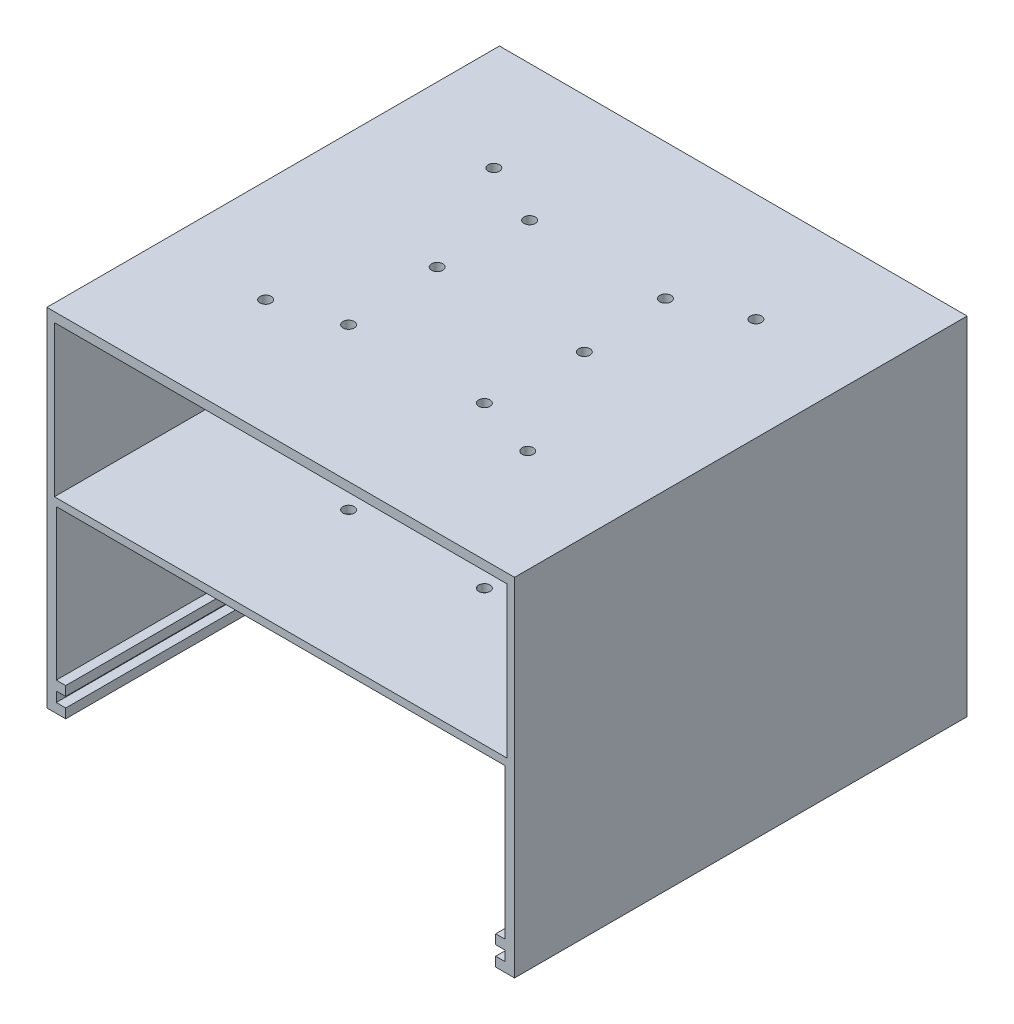
from build123d import *

# Parameters (mm, degrees)
SKETCH_2_W          = 124
SKETCH_2_H          = 120
EXTRUDE_1_DEPTH     = 2
SKETCH_3_W          = 2
SKETCH_3_H          = 120
EXTRUDE_2_DEPTH     = 40
SKETCH_4_W          = 120
SKETCH_4_H          = 2
EXTRUDE_3_DEPTH     = 5
SKETCH_6_W          = 124
SKETCH_6_H          = 120
EXTRUDE_4_DEPTH     = 2.5
SKETCH_9_W          = 124
SKETCH_9_H          = 1.5
EXTRUDE_5_DEPTH     = 25
SKETCH_10_R         = 1.5
CUT_EXTRUDE_2_DEPTH = 1.5
SKETCH_11_R         = 1.5
CUT_EXTRUDE_3_DEPTH = 51
SKETCH_12_W         = 2.5
SKETCH_12_H         = 120
EXTRUDE_6_DEPTH     = 47.5
SKETCH_14_W         = 2.5
SKETCH_14_H         = 2.5
EXTRUDE_8_DEPTH     = 120
SKETCH_15_W         = 119
SKETCH_15_H         = 3
EXTRUDE_9_DEPTH     = 47.5
SKETCH_16_R         = 2.5
CUT_EXTRUDE_4_DEPTH = 10
SKETCH_18_W         = 2.5
SKETCH_18_H         = 2.5
EXTRUDE_10_DEPTH    = 120
SKETCH_20_W         = 124
SKETCH_20_H         = 25
CUT_EXTRUDE_5_DEPTH = 10
SKETCH_19_R         = 1.5
CUT_EXTRUDE_6_DEPTH = 2.5


with BuildPart() as part:
    # 草图2 → 凸台-拉伸1 (new body)
    with BuildSketch(Plane(origin=(0, 0, 0), x_dir=(1, 0, 0), z_dir=(0, 1, 0))):
        Rectangle(SKETCH_2_W, SKETCH_2_H)
    extrude(amount=EXTRUDE_1_DEPTH)

    # 草图3 → 凸台-拉伸2 (add)
    with BuildSketch(Plane(origin=(0, 2, 0), x_dir=(1, 0, 0), z_dir=(0, 1, 0))):
        with Locations((-61, 0)):
            Rectangle(SKETCH_3_W, SKETCH_3_H)
        with Locations((61, 0)):
            Rectangle(SKETCH_3_W, SKETCH_3_H)
    extrude(amount=EXTRUDE_2_DEPTH)

    # 草图4 → 凸台-拉伸3 (add)
    with BuildSketch(Plane(origin=(0, 2, 0), x_dir=(1, 0, 0), z_dir=(0, 1, 0))):
        with Locations((0, 59)):
            Rectangle(SKETCH_4_W, SKETCH_4_H)
    extrude(amount=EXTRUDE_3_DEPTH)

    # 草图6 → 凸台-拉伸4 (add)
    with BuildSketch(Plane(origin=(0, 42, 0), x_dir=(1, 0, 0), z_dir=(0, 1, 0))):
        Rectangle(SKETCH_6_W, SKETCH_6_H)
    extrude(amount=EXTRUDE_4_DEPTH)

    # 草图9 → 凸台-拉伸5 (add)
    with BuildSketch(Plane(origin=(0, 44.5, 0), x_dir=(1, 0, 0), z_dir=(0, 1, 0))):
        with Locations((0, 34.25)):
            Rectangle(SKETCH_9_W, SKETCH_9_H)
    extrude(amount=EXTRUDE_5_DEPTH)

    # 草图10 → 切除-拉伸2 (cut)
    with BuildSketch(Plane(origin=(0, 0, -35), x_dir=(-1, 0, 0), z_dir=(0, 0, -1))):
        with Locations((-22.5, 58)):
            Circle(SKETCH_10_R)
        with Locations((22.5, 58)):
            Circle(SKETCH_10_R)
    extrude(amount=-CUT_EXTRUDE_2_DEPTH, mode=Mode.SUBTRACT)

    # 草图11 → 切除-拉伸3 (cut)
    with BuildSketch(Plane(origin=(0, 44.5, 0), x_dir=(1, 0, 0), z_dir=(0, 1, 0))):
        with Locations(Location((-19.5, 1, 0), (0, 0, 270))):
            Circle(SKETCH_11_R)
        with Locations(Location((-18, 24, 0), (0, 0, 270))):
            Circle(SKETCH_11_R)
        with Locations(Location((-18, -24, 0), (0, 0, 270))):
            Circle(SKETCH_11_R)
        with Locations(Location((18, -24, 0), (0, 0, 270))):
            Circle(SKETCH_11_R)
        with Locations(Location((19.5, 1, 0), (0, 0, 270))):
            Circle(SKETCH_11_R)
        with Locations(Location((18, 24, 0), (0, 0, 270))):
            Circle(SKETCH_11_R)
    extrude(amount=-CUT_EXTRUDE_3_DEPTH, mode=Mode.SUBTRACT)

    # 草图12 → 凸台-拉伸6 (add)
    with BuildSketch(Plane.XZ):
        with Locations((-60.75, 0)):
            Rectangle(SKETCH_12_W, SKETCH_12_H)
        with Locations((60.75, 0)):
            Rectangle(SKETCH_12_W, SKETCH_12_H)
    extrude(amount=EXTRUDE_6_DEPTH)

    # 草图14 → 凸台-拉伸8 (add)
    with BuildSketch(Plane(origin=(0, 0, -60), x_dir=(-1, 0, 0), z_dir=(0, 0, -1))):
        with Locations((-58.25, -46.25)):
            Rectangle(SKETCH_14_W, SKETCH_14_H)
        with Locations((58.25, -46.25)):
            Rectangle(SKETCH_14_W, SKETCH_14_H)
    extrude(amount=-EXTRUDE_8_DEPTH)

    # 草图15 → 凸台-拉伸9 (add)
    with BuildSketch(Plane.XZ):
        with Locations((0, -58.5)):
            Rectangle(SKETCH_15_W, SKETCH_15_H)
    extrude(amount=EXTRUDE_9_DEPTH)

    # 草图16 → 切除-拉伸4 (cut)
    with BuildSketch(Plane.ZY.offset(62)):
        with Locations((2.778789214, 31.36631919)):
            Circle(SKETCH_16_R)
        with Locations((2.778789214, -33.63368081)):
            Circle(SKETCH_16_R)
    extrude(amount=-CUT_EXTRUDE_4_DEPTH, mode=Mode.SUBTRACT)

    # 草图18 → 凸台-拉伸10 (add)
    with BuildSketch(Plane.XY.offset(60)):
        with Locations((-58.25, -41.1)):
            Rectangle(SKETCH_18_W, SKETCH_18_H)
        with Locations((58.25, -41.1)):
            Rectangle(SKETCH_18_W, SKETCH_18_H)
    extrude(amount=-EXTRUDE_10_DEPTH)

    # 草图20 → 切除-拉伸5 (cut)
    with BuildSketch(Plane(origin=(0, 0, -35), x_dir=(-1, 0, 0), z_dir=(0, 0, -1))):
        with Locations((0, 57)):
            Rectangle(SKETCH_20_W, SKETCH_20_H)
    extrude(amount=-CUT_EXTRUDE_5_DEPTH, mode=Mode.SUBTRACT)

    # 草图19 → 切除-拉伸6 (cut)
    with BuildSketch(Plane(origin=(0, 44.5, 0), x_dir=(1, 0, 0), z_dir=(0, 1, 0))):
        with Locations(Location((-34.75, -29.25, 0), (0, 0, 270))):
            Circle(SKETCH_19_R)
        with Locations(Location((-34.740182935, 31.25, 0), (0, 0, 270))):
            Circle(SKETCH_19_R)
        with Locations(Location((34.75, 31.25, 0), (0, 0, 270))):
            Circle(SKETCH_19_R)
        with Locations(Location((34.75, -29.25, 0), (0, 0, 270))):
            Circle(SKETCH_19_R)
    extrude(amount=-CUT_EXTRUDE_6_DEPTH, mode=Mode.SUBTRACT)


solid = part.part
